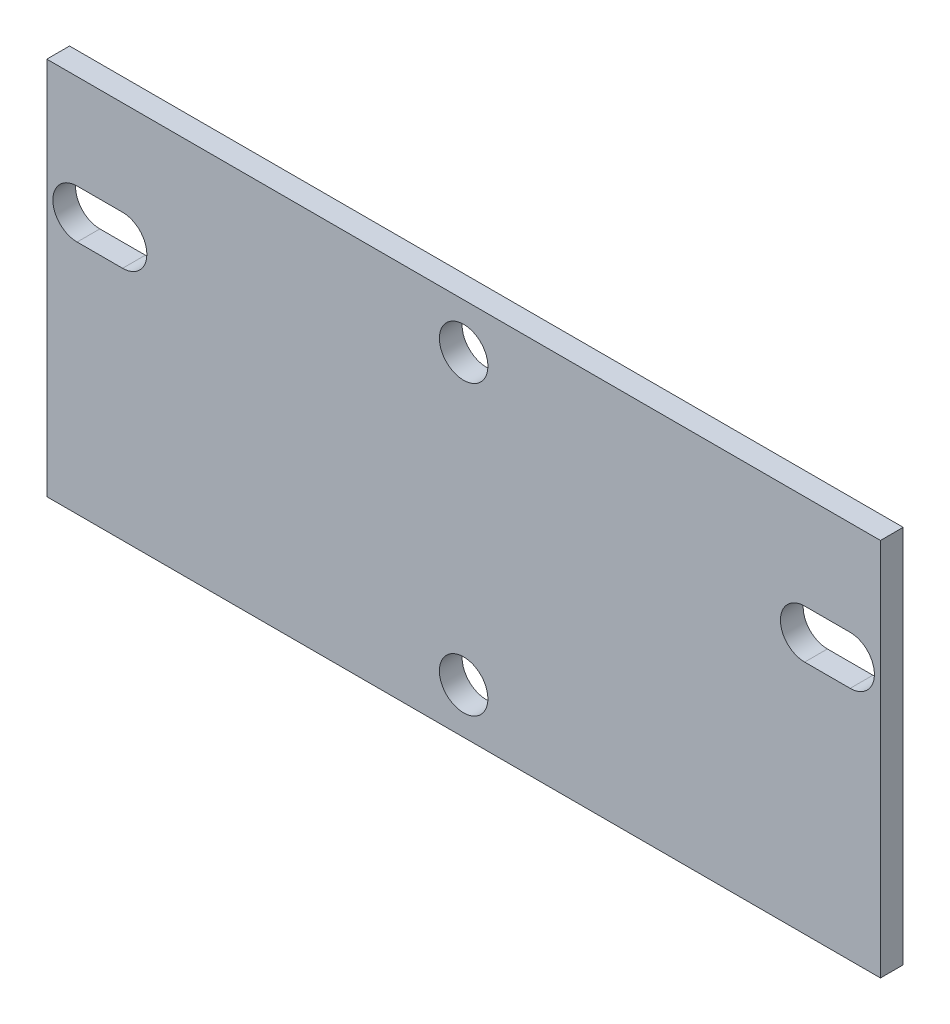
from build123d import *

# Parameters (mm, degrees)
SKETCH_1_W          = 55
SKETCH_1_H          = 25
EXTRUDE_1_DEPTH     = 1.5
CUT_EXTRUDE_1_DEPTH = 61.433848132
SKETCH_3_R          = 1.6
CUT_EXTRUDE_2_DEPTH = 61.433848132


with BuildPart() as part:
    # Эскиз1 → Бобышка-Вытянуть1 (new body)
    with BuildSketch(Plane.XY):
        with Locations((27.5, 12.5)):
            Rectangle(SKETCH_1_W, SKETCH_1_H)
    extrude(amount=EXTRUDE_1_DEPTH)

    # Эскиз2 → Вырез-Вытянуть1 (cut, through all)
    with BuildSketch(Plane.XY.offset(1.5)):
        with BuildLine():
            Line((2, 18.75), (5, 18.75))
            ThreePointArc((5, 18.75), (6.6, 17.15), (5, 15.55))
            Line((5, 15.55), (2, 15.55))
            ThreePointArc((2, 15.55), (0.4, 17.15), (2, 18.75))
        make_face()
        with BuildLine():
            Line((53, 18.75), (50, 18.75))
            ThreePointArc((50, 18.75), (48.4, 17.15), (50, 15.55))
            Line((50, 15.55), (53, 15.55))
            ThreePointArc((53, 15.55), (54.6, 17.15), (53, 18.75))
        make_face()
    extrude(amount=-CUT_EXTRUDE_1_DEPTH, mode=Mode.SUBTRACT)

    # Эскиз3 → Вырез-Вытянуть2 (cut, through all)
    with BuildSketch(Plane.XY.offset(1.5)):
        with Locations((27.5, 22)):
            Circle(SKETCH_3_R)
        with Locations((27.5, 3)):
            Circle(SKETCH_3_R)
    extrude(amount=-CUT_EXTRUDE_2_DEPTH, mode=Mode.SUBTRACT)


solid = part.part
